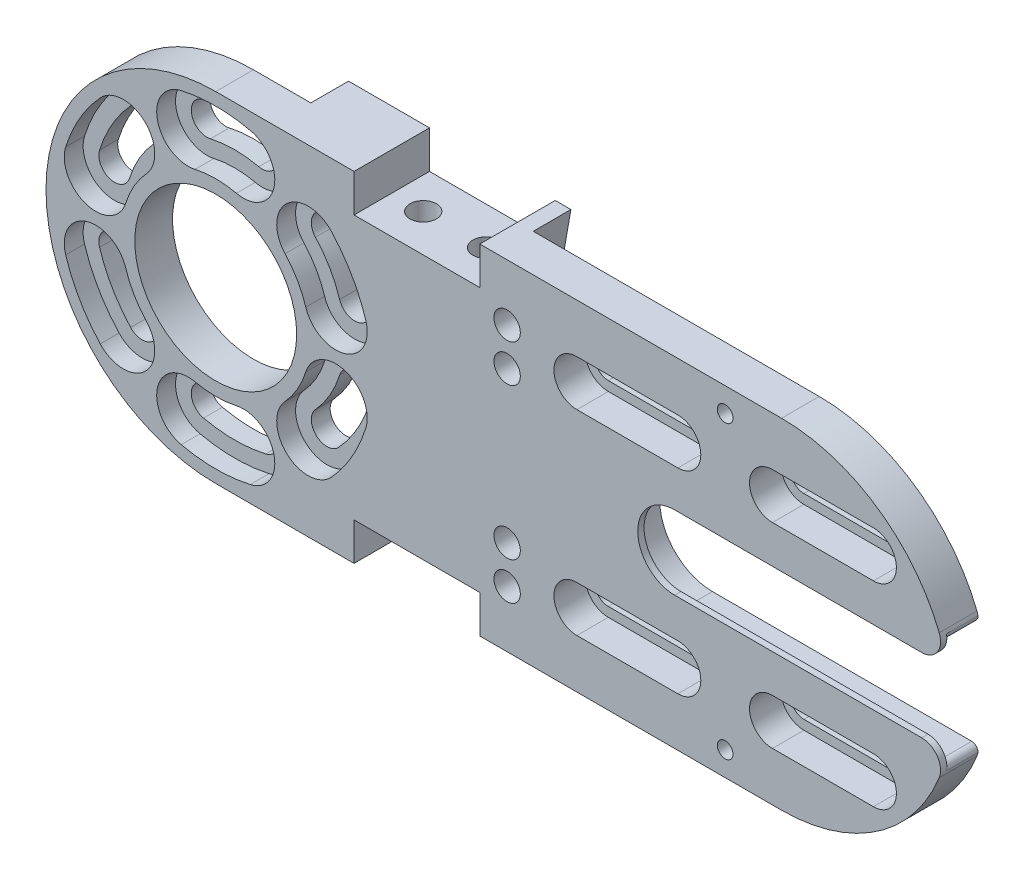
from build123d import *

# Parameters (mm, degrees)
BOSS_EXTRUDE1_DEPTH            = 6
SKETCH2_R                      = 12.875
CUT_EXTRUDE1_DEPTH             = 78.129760793
CUT_EXTRUDE2_DEPTH             = 3
CUT_EXTRUDE3_DEPTH             = 78.129760793
CIRPATTERN1_COUNT              = 6
CUT_EXTRUDE4_DEPTH             = 5
FILLET1_R                      = 1
CUT_EXTRUDE5_DEPTH             = 78.129760793
FILLET2_R                      = 3
CUT_EXTRUDE6_DEPTH             = 5
CUT_EXTRUDE7_DEPTH             = 78.129760793
M3X0_5_TAPPED_HOLE1_D          = 2.5
M5X0_8_TAPPED_HOLE1_D          = 4.2
BOSS_EXTRUDE2_DEPTH            = 6
SKETCH15_W                     = 20
SKETCH15_H                     = 6
CUT_EXTRUDE8_DEPTH             = 78.826730626
M5X0_8_TAPPED_HOLE2_AT_2_COUNT = 2
M5X0_8_TAPPED_HOLE2_AT_2_PITCH = 10


with BuildPart() as part:
    # Sketch1 → Boss-Extrude1 (new body)
    with BuildSketch(Plane.XY):
        with BuildLine():
            Line((45, -27), (-45, -27))
            ThreePointArc((-45, -27), (-72, 0), (-45, 27))
            Line((-45, 27), (45, 27))
            ThreePointArc((45, 27), (72, 0), (45, -27))
        make_face()
    extrude(amount=BOSS_EXTRUDE1_DEPTH)

    # Sketch2 → Cut-Extrude1 (cut, through all)
    with BuildSketch(Plane.XY.offset(6)):
        with Locations((-45, 0)):
            Circle(SKETCH2_R)
    extrude(amount=-CUT_EXTRUDE1_DEPTH, mode=Mode.SUBTRACT)

    # Sketch3 → Cut-Extrude2 (cut)
    with BuildSketch(Plane.XY.offset(6)):
        with BuildLine():
            ThreePointArc((-39.507041214, 24.389083701), (-45, 25), (-50.492958786, 24.389083701))
            ThreePointArc((-50.492958786, 24.389083701), (-54.272183769, 18.412675204), (-48.295775272, 14.633450221))
            ThreePointArc((-48.295775272, 14.633450221), (-45, 15), (-41.704224728, 14.633450221))
            ThreePointArc((-41.704224728, 14.633450221), (-35.727816231, 18.412675204), (-39.507041214, 24.389083701))
        make_face()
    cut_extrude2 = extrude(amount=-CUT_EXTRUDE2_DEPTH, mode=Mode.SUBTRACT)

    # Sketch4 → Cut-Extrude3 (cut, through all)
    with BuildSketch(Plane.XY.offset(6)):
        with BuildLine():
            ThreePointArc((-40.056337093, 21.950175331), (-45, 22.5), (-49.943662907, 21.950175331))
            ThreePointArc((-49.943662907, 21.950175331), (-51.833275399, 18.961971082), (-48.84507115, 17.072358591))
            ThreePointArc((-48.84507115, 17.072358591), (-45, 17.5), (-41.15492885, 17.072358591))
            ThreePointArc((-41.15492885, 17.072358591), (-38.166724601, 18.961971082), (-40.056337093, 21.950175331))
        make_face()
    cut_extrude3 = extrude(amount=-CUT_EXTRUDE3_DEPTH, mode=Mode.SUBTRACT)

    # CirPattern1: Cut-Extrude2, Cut-Extrude3 ×6 about axis
    cirpattern1_axis = Axis((-45, 0, 0), (0, 0, 1))
    add([cut_extrude2.rotate(cirpattern1_axis, i * 360 / CIRPATTERN1_COUNT) for i in range(1, CIRPATTERN1_COUNT)], mode=Mode.SUBTRACT)
    add([cut_extrude3.rotate(cirpattern1_axis, i * 360 / CIRPATTERN1_COUNT) for i in range(1, CIRPATTERN1_COUNT)], mode=Mode.SUBTRACT)

    # Sketch5 → Cut-Extrude4 (cut)
    with BuildSketch(Plane(origin=(0, 0, 0), x_dir=(-1, 0, 0), z_dir=(0, 0, -1))):
        with BuildLine():
            Line((-72, 8.375), (-28, 8.375))
            ThreePointArc((-28, 8.375), (-19.625, 0), (-28, -8.375))
            Line((-28, -8.375), (-72, -8.375))
            ThreePointArc((-72, -8.375), (-80.375, 0), (-72, 8.375))
        make_face()
    extrude(amount=-CUT_EXTRUDE4_DEPTH, mode=Mode.SUBTRACT)

    # Fillet1
    fillet1_edges = [part.edges().sort_by_distance(p)[0] for p in [
        (70.668256174, 8.375, 2.5),
        (70.668256174, -8.375, 2.5),
    ]]
    fillet(fillet1_edges, radius=FILLET1_R)

    # Sketch6 → Cut-Extrude5 (cut, through all)
    with BuildSketch(Plane(origin=(0, 0, 0), x_dir=(-1, 0, 0), z_dir=(0, 0, -1))):
        with BuildLine():
            Line((-72, 5.875), (-28, 5.875))
            ThreePointArc((-28, 5.875), (-22.125, 0), (-28, -5.875))
            Line((-28, -5.875), (-72, -5.875))
            ThreePointArc((-72, -5.875), (-77.875, 0), (-72, 5.875))
        make_face()
    extrude(amount=-CUT_EXTRUDE5_DEPTH, mode=Mode.SUBTRACT)

    # Fillet2
    fillet2_edges = [part.edges().sort_by_distance(p)[0] for p in [
        (71.353071453, -5.875, 5.5),
        (71.353071453, 5.875, 5.5),
    ]]
    fillet(fillet2_edges, radius=FILLET2_R)

    # Sketch7 → Cut-Extrude6 (cut)
    with BuildSketch(Plane.XY.offset(6)):
        with BuildLine():
            Line((28.506349186, 11.906349186), (12.443650814, 11.906349186))
            ThreePointArc((12.443650814, 11.906349186), (8.793650814, 15.556349186), (12.443650814, 19.206349186))
            Line((12.443650814, 19.206349186), (28.506349186, 19.206349186))
            ThreePointArc((28.506349186, 19.206349186), (32.156349186, 15.556349186), (28.506349186, 11.906349186))
        make_face()
        with BuildLine():
            Line((59.619047558, 11.906349186), (43.556349186, 11.906349186))
            ThreePointArc((43.556349186, 11.906349186), (39.906349186, 15.556349186), (43.556349186, 19.206349186))
            Line((43.556349186, 19.206349186), (59.619047558, 19.206349186))
            ThreePointArc((59.619047558, 19.206349186), (63.269047558, 15.556349186), (59.619047558, 11.906349186))
        make_face()
    cut_extrude6 = extrude(amount=-CUT_EXTRUDE6_DEPTH, mode=Mode.SUBTRACT)

    # Sketch8 → Cut-Extrude7 (cut, through all)
    with BuildSketch(Plane.XY.offset(6)):
        with BuildLine():
            Line((12.443650814, 17.706349186), (28.506349186, 17.706349186))
            ThreePointArc((28.506349186, 17.706349186), (30.656349186, 15.556349186), (28.506349186, 13.406349186))
            Line((28.506349186, 13.406349186), (12.443650814, 13.406349186))
            ThreePointArc((12.443650814, 13.406349186), (10.293650814, 15.556349186), (12.443650814, 17.706349186))
        make_face()
        with BuildLine():
            Line((43.556349186, 17.706349186), (59.619047558, 17.706349186))
            ThreePointArc((59.619047558, 17.706349186), (61.769047558, 15.556349186), (59.619047558, 13.406349186))
            Line((59.619047558, 13.406349186), (43.556349186, 13.406349186))
            ThreePointArc((43.556349186, 13.406349186), (41.406349186, 15.556349186), (43.556349186, 17.706349186))
        make_face()
    cut_extrude7 = extrude(amount=-CUT_EXTRUDE7_DEPTH, mode=Mode.SUBTRACT)

    # M3x0.5 Tapped Hole1 (through all)
    with Locations(Plane.XY.offset(6)):
        with Locations((36.031349186, 23.15)):
            m3x0_5_tapped_hole1 = Hole(M3X0_5_TAPPED_HOLE1_D / 2)

    # M5x0.8 Tapped Hole1 (through all)
    with Locations(Plane.XY.offset(6)):
        with Locations((1.349738949, 12), (1.349738949, 18)):
            m5x0_8_tapped_hole1 = Hole(M5X0_8_TAPPED_HOLE1_D / 2)

    # Sketch14 → Boss-Extrude2 (add)
    with BuildSketch(Plane(origin=(0, 0, 0), x_dir=(-1, 0, 0), z_dir=(0, 0, -1))):
        with BuildLine():
            Line((0.5, 27), (3.166945583, 11.875))
            Line((3.166945583, 11.875), (19.091808728, 11.875))
            ThreePointArc((19.091808728, 11.875), (25.921018598, 21.171737498), (35.875856205, 27))
            Line((35.875856205, 27), (0.5, 27))
        make_face()
    boss_extrude2 = extrude(amount=BOSS_EXTRUDE2_DEPTH)

    # Sketch15 → Cut-Extrude8 (cut, through all)
    with BuildSketch(Plane.XY.offset(6)):
        with Locations((-13, 24)):
            Rectangle(SKETCH15_W, SKETCH15_H)
    cut_extrude8 = extrude(amount=-CUT_EXTRUDE8_DEPTH, mode=Mode.SUBTRACT)

    # Sketch17 → M5x0.8 Tapped Hole2 (revolve, cut)
    with BuildSketch(Plane(origin=(-18, 21, 0), x_dir=(0, 0, 1), z_dir=(1, 0, 0))):
        Polygon((0, 0), (0, 6.2618073), (2.1, 5), (2.1, 0), align=None)
    m5x0_8_tapped_hole2 = revolve(axis=Axis((-18, 27.35, 0), (0, -1, 0)), mode=Mode.SUBTRACT)

    # M5x0.8 Tapped Hole2 at 2: M5x0.8 Tapped Hole2 ×2
    with Locations(*[(i * M5X0_8_TAPPED_HOLE2_AT_2_PITCH, 0, 0) for i in range(1, M5X0_8_TAPPED_HOLE2_AT_2_COUNT)]):
        add(m5x0_8_tapped_hole2, mode=Mode.SUBTRACT)

    # Mirror1: Cut-Extrude6, Cut-Extrude7, M3x0.5 Tapped Hole1, M5x0.8 Tapped Hole1, Boss-Extrude2, Cut-Extrude8, M5x0.8 Tapped Hole2 across plane
    add(cut_extrude6.mirror(Plane.ZX), mode=Mode.SUBTRACT)
    add(cut_extrude7.mirror(Plane.ZX), mode=Mode.SUBTRACT)
    add(m3x0_5_tapped_hole1.mirror(Plane.ZX), mode=Mode.SUBTRACT)
    add(m5x0_8_tapped_hole1.mirror(Plane.ZX), mode=Mode.SUBTRACT)
    add(boss_extrude2.mirror(Plane.ZX))
    add(cut_extrude8.mirror(Plane.ZX), mode=Mode.SUBTRACT)
    add(m5x0_8_tapped_hole2.mirror(Plane.ZX), mode=Mode.SUBTRACT)

    # Mirror1 copy 1 sketch → Mirror1 copy 1 (revolve, cut)
    with BuildSketch(Plane(origin=(-8, -21, 0), x_dir=(0, 0, 1), z_dir=(1, 0, 0))):
        Polygon((0, 0), (0, -6.2618073), (2.1, -5), (2.1, 0), align=None)
    revolve(axis=Axis((-8, -27.35, 0), (0, -1, 0)), mode=Mode.SUBTRACT)


solid = part.part
